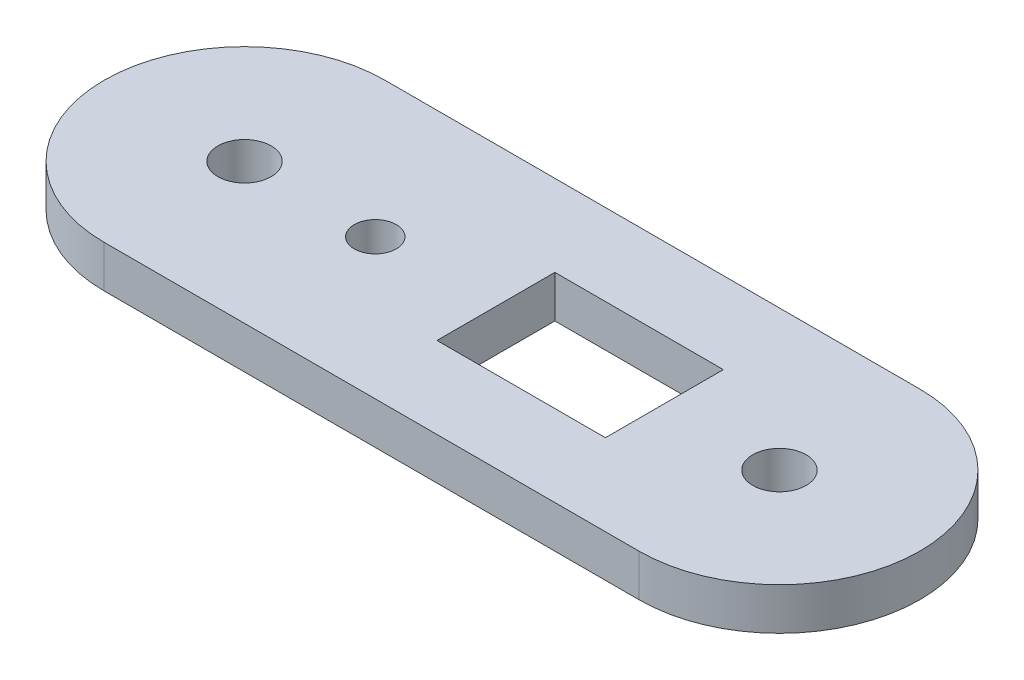
from build123d import *

# Parameters (mm, degrees)
SKETCH1_R           = 1.5
SKETCH1_R_2         = 1.9
SKETCH1_W           = 12
SKETCH1_H           = 8.4
BOSS_EXTRUDE1_DEPTH = 3


with BuildPart() as part:
    # Sketch1 → Boss-Extrude1 (new body)
    with BuildSketch(Plane(origin=(0, 0, 0), x_dir=(1, 0, 0), z_dir=(0, 1, 0))):
        with BuildLine():
            Line((-19.05, 10), (19.05, 10))
            ThreePointArc((19.05, 10), (29.05, 0), (19.05, -10))
            Line((19.05, -10), (-19.05, -10))
            ThreePointArc((-19.05, -10), (-29.05, 0), (-19.05, 10))
        make_face()
        with Locations(Location((-9.73765424, 0, 0), (0, 0, 270))):
            Circle(SKETCH1_R, mode=Mode.SUBTRACT)
        with Locations(Location((-19.05, 0, 0), (0, 0, 270))):
            Circle(SKETCH1_R_2, mode=Mode.SUBTRACT)
        with Locations(Location((19.05, 0, 0), (0, 0, 270))):
            Circle(SKETCH1_R_2, mode=Mode.SUBTRACT)
        with Locations((4.854803124, 0)):
            Rectangle(SKETCH1_W, SKETCH1_H, mode=Mode.SUBTRACT)
    extrude(amount=BOSS_EXTRUDE1_DEPTH)


solid = part.part
